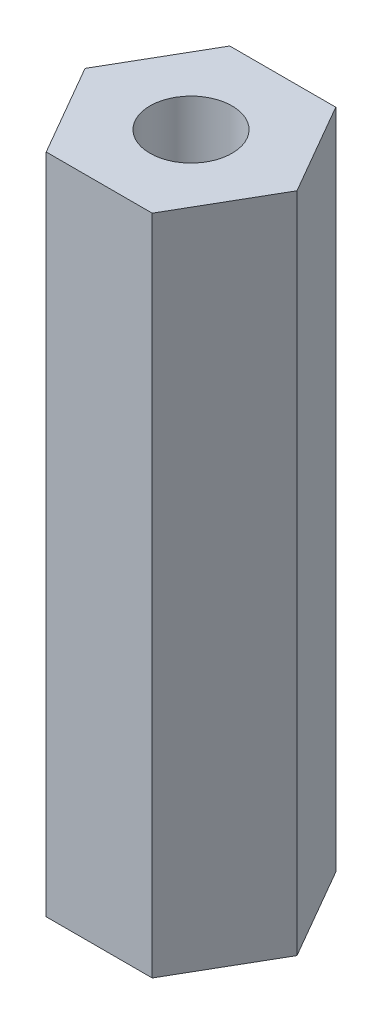
from build123d import *

# Parameters (mm, degrees)
SKETCH_1_R      = 1.55
EXTRUDE_1_DEPTH = 25


with BuildPart() as part:
    # 草圖1 → 填料-伸長1 (new body)
    with BuildSketch(Plane(origin=(0, 0, 0), x_dir=(1, 0, 0), z_dir=(0, 1, 0))):
        Polygon((2, 3.464101615), (-2, 3.464101615), (-4, 0), (-2, -3.464101615), (2, -3.464101615), (4, 0), align=None)
        with Locations(Location((0, 0, 0), (0, 0, 270))):
            Circle(SKETCH_1_R, mode=Mode.SUBTRACT)
    extrude(amount=EXTRUDE_1_DEPTH)


solid = part.part
